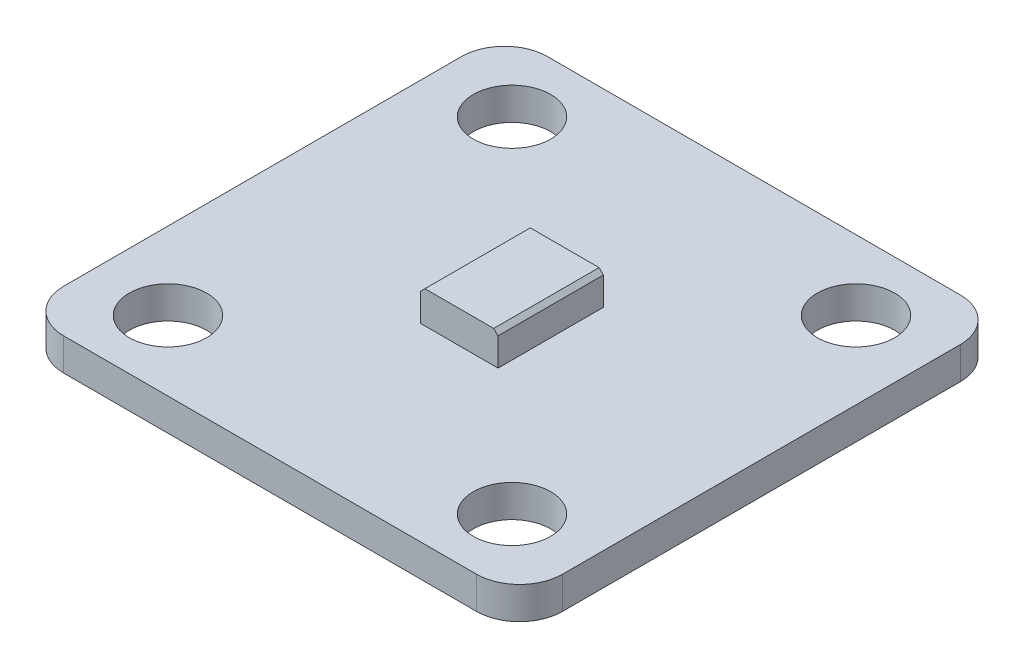
from build123d import *

# Parameters (mm, degrees)
SKETCH_1_W          = 23.2
SKETCH_1_H          = 22.5
EXTRUDE_1_DEPTH     = 1.5
FILLET_1_R          = 2
SKETCH_2_R          = 1.8
CUT_EXTRUDE_1_DEPTH = 1.5
SKETCH_3_W          = 3.6
SKETCH_3_H          = 4.9
EXTRUDE_2_DEPTH     = 1.5
CHAMFER_1_SIZE      = 0.2
SKETCH_17_R         = 0.5
CUT_EXTRUDE_2_DEPTH = 0.1


with BuildPart() as part:
    # 草图1 → 凸台-拉伸1 (new body)
    with BuildSketch(Plane(origin=(0, 0, 0), x_dir=(1, 0, 0), z_dir=(0, 1, 0))):
        Rectangle(SKETCH_1_W, SKETCH_1_H)
    extrude(amount=EXTRUDE_1_DEPTH)

    # 圆角1
    fillet_1_edges = [part.edges().sort_by_distance(p)[0] for p in [
        (11.6, 0.75, 11.25),
        (-11.6, 0.75, 11.25),
        (-11.6, 0.75, -11.25),
        (11.6, 0.75, -11.25),
    ]]
    fillet(fillet_1_edges, radius=FILLET_1_R)

    # 草图2 → 切除-拉伸1 (cut)
    with BuildSketch(Plane.XZ):
        with Locations(Location((-8, 8, 0), (0, 0, 270))):
            Circle(SKETCH_2_R)
        with Locations(Location((8, 8, 0), (0, 0, 270))):
            Circle(SKETCH_2_R)
        with Locations(Location((8, -8, 0), (0, 0, 270))):
            Circle(SKETCH_2_R)
        with Locations(Location((-8, -8, 0), (0, 0, 270))):
            Circle(SKETCH_2_R)
    extrude(amount=-CUT_EXTRUDE_1_DEPTH, mode=Mode.SUBTRACT)

    # 草图3 → 凸台-拉伸2 (add)
    with BuildSketch(Plane(origin=(0, 1.5, 0), x_dir=(1, 0, 0), z_dir=(0, 1, 0))):
        Rectangle(SKETCH_3_W, SKETCH_3_H)
    extrude(amount=EXTRUDE_2_DEPTH)

    # 倒角1
    chamfer_1_edges = [part.edges().sort_by_distance(p)[0] for p in [
        (1.8, 3, 0),
        (-1.8, 3, 0),
    ]]
    chamfer(chamfer_1_edges, length=CHAMFER_1_SIZE)

    # 草图17 → 切除-拉伸2 (cut)
    with BuildSketch(Plane.XZ):
        with Locations(Location((0, 0, 0), (0, 0, 270))):
            Circle(SKETCH_17_R)
    extrude(amount=-CUT_EXTRUDE_2_DEPTH, mode=Mode.SUBTRACT)


solid = part.part
